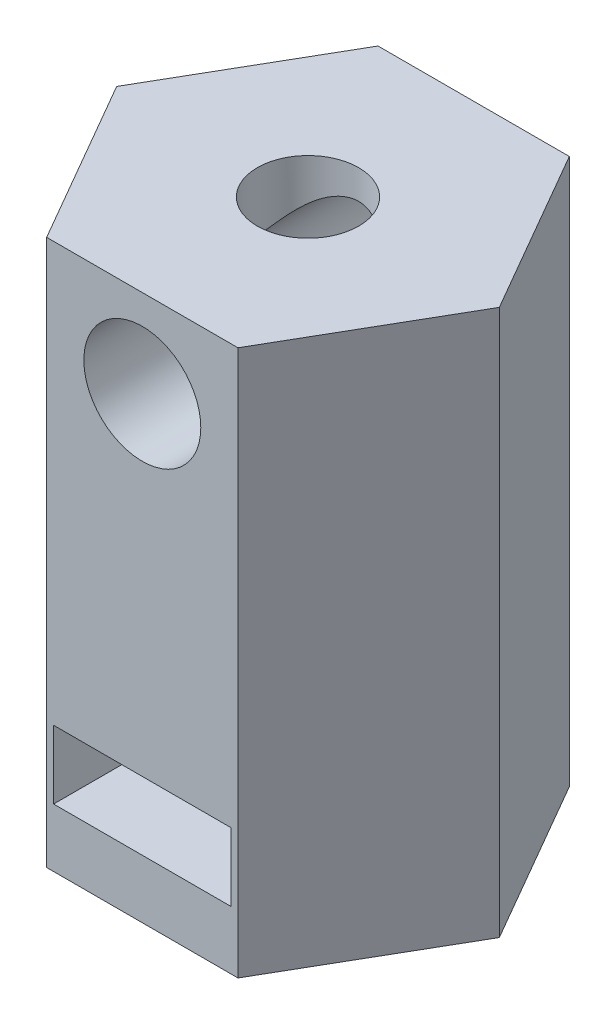
from build123d import *

# Parameters (mm, degrees)
SKETCH2_R           = 2.6
CORE_DEPTH          = 11
SKETCH5_W           = 9.1
SKETCH5_H           = 3.5
HEX_NUT_DEPTH       = 14.2
BOLT_GUARD_DEPTH    = 2
SKETCH7_R           = 2.6
D_SHAFT_DEPTH       = 15
SKETCH8_R           = 3
SET_SCREW_DEPTH     = 35.195516275
BOSS_EXTRUDE1_REACH = 27.116


with BuildPart() as part:
    # Sketch2 → core (new body)
    with BuildSketch(Plane(origin=(0, 0, 0), x_dir=(1, 0, 0), z_dir=(0, 1, 0))):
        Polygon((9.814954576, 0), (4.907477288, 8.5), (-4.907477288, 8.5), (-9.814954576, 0), (-4.907477288, -8.5), (4.907477288, -8.5), align=None)
        with Locations(Location((0, 0, 0), (0, 0, 270))):
            Circle(SKETCH2_R, mode=Mode.SUBTRACT)
    extrude(amount=CORE_DEPTH)

    # Sketch5 → hex-nut (cut)
    with BuildSketch(Plane.XY.offset(8.5)):
        with Locations((0, 4.75)):
            Rectangle(SKETCH5_W, SKETCH5_H)
    extrude(amount=-HEX_NUT_DEPTH, mode=Mode.SUBTRACT)

    # Sketch4 → bolt-guard (add)
    with BuildSketch(Plane(origin=(0, 11, 0), x_dir=(1, 0, 0), z_dir=(0, 1, 0))):
        Polygon((9.814954576, 0), (4.907477288, 8.5), (-4.907477288, 8.5), (-9.814954576, 0), (-4.907477288, -8.5), (4.907477288, -8.5), align=None)
    extrude(amount=BOLT_GUARD_DEPTH)

    # Sketch7 → d-shaft (add)
    with BuildSketch(Plane(origin=(0, 13, 0), x_dir=(1, 0, 0), z_dir=(0, 1, 0))):
        Polygon((9.814954576, 0), (4.907477288, 8.5), (-4.907477288, 8.5), (-9.814954576, 0), (-4.907477288, -8.5), (4.907477288, -8.5), align=None)
        Circle(SKETCH7_R, mode=Mode.SUBTRACT)
    extrude(amount=D_SHAFT_DEPTH)

    # Sketch8 → set-screw (cut, through all)
    with BuildSketch(Plane.XY.offset(8.5)):
        with Locations((0, 23.5)):
            Circle(SKETCH8_R)
    extrude(amount=-SET_SCREW_DEPTH, mode=Mode.SUBTRACT)

    # Sketch9 → Boss-Extrude1 (add, up to next)
    with BuildSketch(Plane.XZ.offset(-6.5), mode=Mode.PRIVATE) as boss_extrude1_sk1:
        Polygon((4.55, -5.7), (4.55, 0), (2.275, -3.940415587), (-2.275, -3.940415587), (-4.55, 0), (-4.55, -5.7), align=None)
    boss_extrude1_tool1 = extrude(boss_extrude1_sk1.sketch, amount=BOSS_EXTRUDE1_REACH, mode=Mode.PRIVATE) - part.part
    add(boss_extrude1_tool1.solids().sort_by_distance((0, 6.5, -4.033017))[0])


solid = part.part
